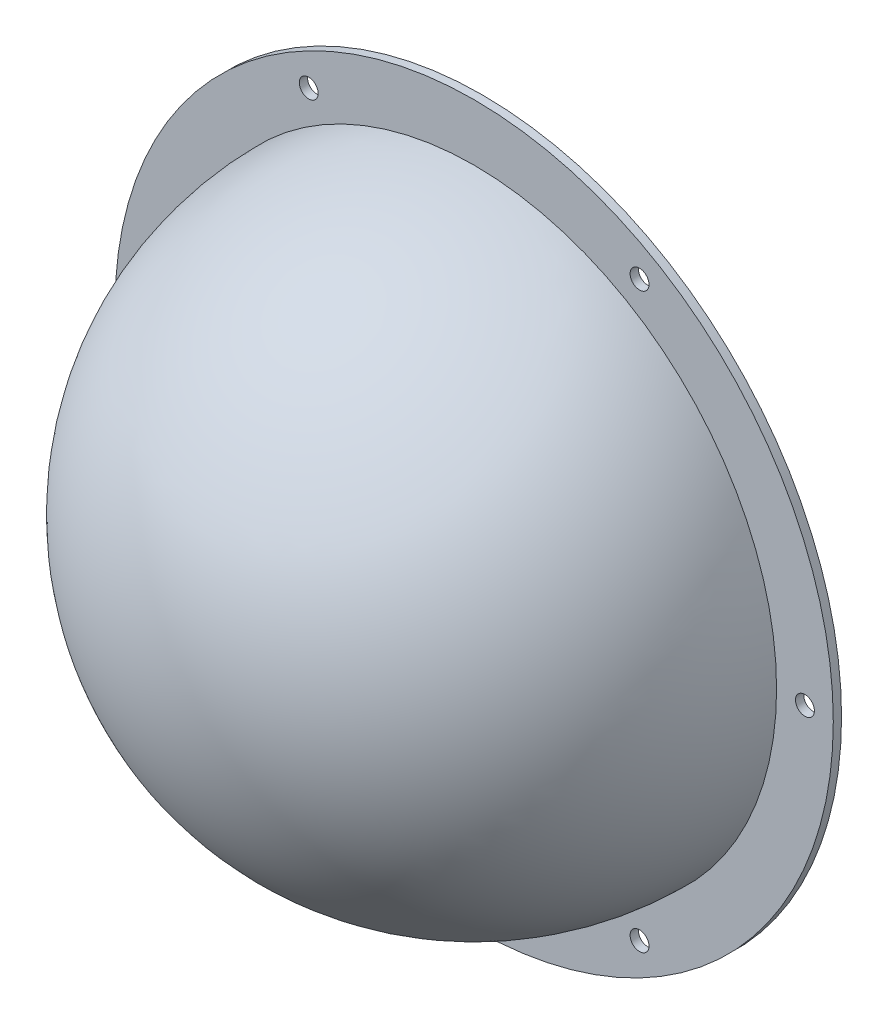
from build123d import *

# Parameters (mm, degrees)
SKETCH2_R          = 3.175
CUT_EXTRUDE1_DEPTH = 199.583496293
CIRPATTERN1_COUNT  = 6


with BuildPart() as part:
    # Sketch1 → Revolve1 (revolve)
    with BuildSketch(Plane(origin=(0, 0, 0), x_dir=(1, 0, 0), z_dir=(0, 1, 0))):
        with BuildLine():
            Line((98.821875, 0), (98.821875, 2.778125))
            Line((98.821875, 2.778125), (120.65, 2.778125))
            Line((120.65, 2.778125), (120.65, 0))
            Line((120.65, 0), (101.6, 0))
            ThreePointArc((101.6, 0), (71.842048969, -71.842048969), (0, -101.6))
            Line((0, -101.6), (0, -98.821875))
            ThreePointArc((0, -98.821875), (69.877617942, -69.877617942), (98.821875, 0))
        make_face()
    revolve(axis=Axis((0, 0, 0), (0, 0, 1)))

    # Sketch2 → Cut-Extrude1 (cut, symmetric)
    with BuildSketch(Plane.XY):
        with Locations((111.125, 0)):
            Circle(SKETCH2_R)
    cut_extrude1 = extrude(amount=CUT_EXTRUDE1_DEPTH, both=True, mode=Mode.SUBTRACT)

    # CirPattern1: Cut-Extrude1 ×6 about axis
    cirpattern1_axis = Axis((0, 0, -6.72703125), (0, 0, 1))
    for i in range(1, CIRPATTERN1_COUNT):
        add(cut_extrude1.rotate(cirpattern1_axis, i * 360 / CIRPATTERN1_COUNT), mode=Mode.SUBTRACT)


solid = part.part
